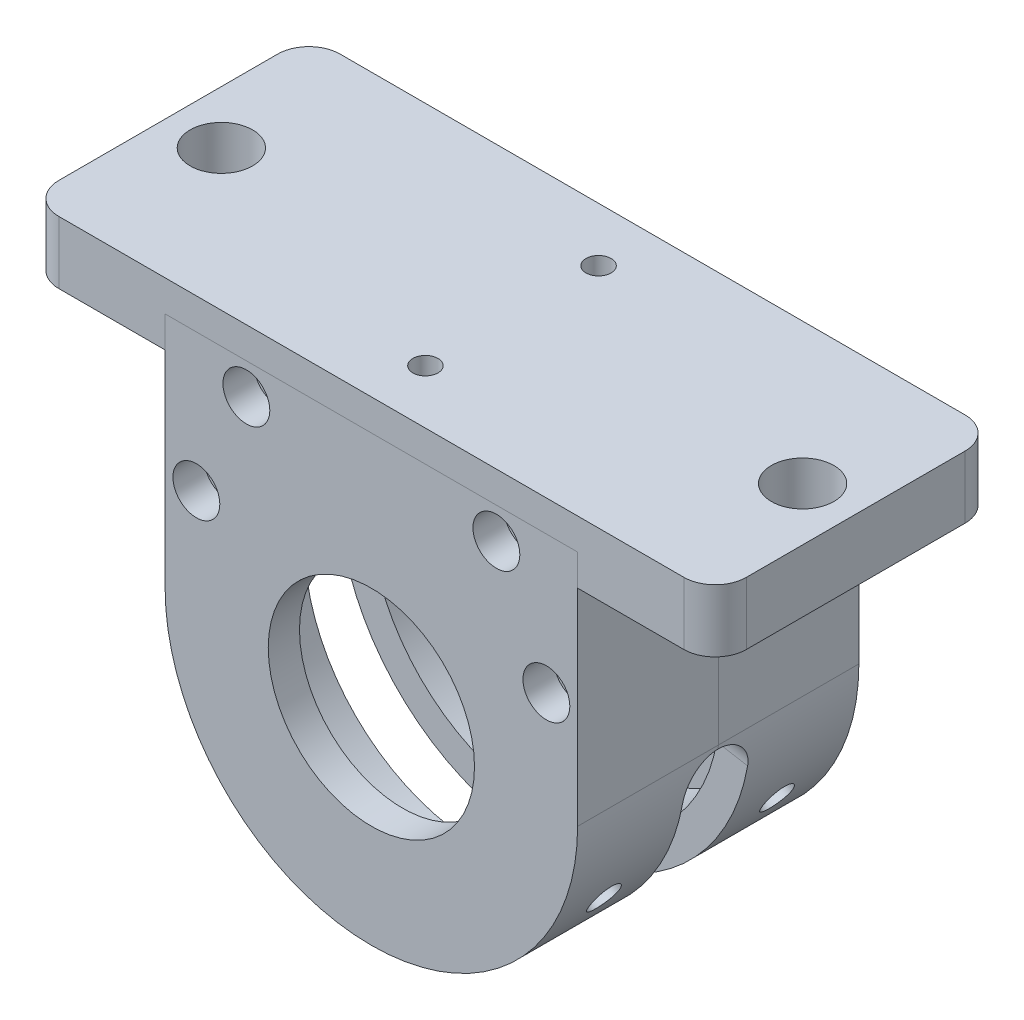
from build123d import *

# Parameters (mm, degrees)
BOSS_EXTRUDE1_DEPTH                          = 57.15
FILLET1_R                                    = 6.35
SKETCH3_R                                    = 6.35
CUT_EXTRUDE1_DEPTH                           = 50.8
SKETCH4_R                                    = 20.955
CUT_EXTRUDE2_DEPTH                           = 124.170359259
CUT_EXTRUDE3_DEPTH                           = 6.604
CUT_EXTRUDE4_REACH                           = 153.412
CUT_EXTRUDE6_START                           = -6.35
SKETCH10_R                                   = 35.56
CUT_EXTRUDE6_DEPTH                           = 117.820359373
SPLIT2_SURFACE_1_BACK                        = 180.16
SPLIT2_SURFACE_1_DEPTH                       = 360.32
SPLIT2_SURFACE_2_BACK                        = 180.16
SPLIT2_SURFACE_2_DEPTH                       = 360.32
SKETCH20_W                                   = 83.82
SKETCH20_H                                   = 90.17
CUT_EXTRUDE8_DEPTH                           = 113.788942488
CBORE_FOR_1_4_SOCKET_HEAD_CAP_SCREW1_2_COUNT = 2
CBORE_FOR_1_4_SOCKET_HEAD_CAP_SCREW1_2_PITCH = 71.12
CBORE_FOR_1_4_SOCKET_HEAD_CAP_SCREW1_3_COUNT = 2
CBORE_FOR_1_4_SOCKET_HEAD_CAP_SCREW1_3_PITCH = 23.86113367
CBORE_FOR_1_4_SOCKET_HEAD_CAP_SCREW1_4_COUNT = 2
CBORE_FOR_1_4_SOCKET_HEAD_CAP_SCREW1_4_PITCH = 64.670315447
F_1_4_20_TAPPED_HOLE1_AT_2_COUNT             = 2
F_1_4_20_TAPPED_HOLE1_AT_2_PITCH             = 35.179
CUT_EXTRUDE9_REACH                           = 148.49
CUT_EXTRUDE9_END_RADIUS                      = 35.56
SKETCH31_R                                   = 3.175


with BuildPart() as part:
    # Sketch1 → Boss-Extrude1 (new body)
    with BuildSketch(Plane.XY):
        with BuildLine():
            Line((-41.91, -41.91), (-41.91, 0))
            Line((-41.91, 0), (-69.85, 0))
            Line((-69.85, 0), (-69.85, 12.7))
            Line((-69.85, 12.7), (69.85, 12.7))
            Line((69.85, 12.7), (69.85, 0))
            Line((69.85, 0), (41.91, 0))
            Line((41.91, 0), (41.91, -41.91))
            ThreePointArc((41.91, -41.91), (0, -83.82), (-41.91, -41.91))
        make_face()
    extrude(amount=BOSS_EXTRUDE1_DEPTH)

    # Fillet1
    fillet1_edges = [part.edges().sort_by_distance(p)[0] for p in [
        (69.85, 6.35, 57.15),
        (69.85, 6.35, 0),
        (-69.85, 6.35, 0),
        (-69.85, 6.35, 57.15),
    ]]
    fillet(fillet1_edges, radius=FILLET1_R)

    # Sketch3 → Cut-Extrude1 (cut)
    with BuildSketch(Plane.XZ):
        with Locations((-59.055, 28.575)):
            Circle(SKETCH3_R)
        with Locations((59.055, 28.575)):
            Circle(SKETCH3_R)
    extrude(amount=-CUT_EXTRUDE1_DEPTH, mode=Mode.SUBTRACT)

    # Sketch4 → Cut-Extrude2 (cut, through all)
    with BuildSketch(Plane.XY.offset(57.15)):
        with Locations((0, -41.91)):
            Circle(SKETCH4_R)
    extrude(amount=-CUT_EXTRUDE2_DEPTH, mode=Mode.SUBTRACT)

    # Sketch6 → Cut-Extrude3 (cut, symmetric)
    with BuildSketch(Plane.XY.offset(28.575)):
        with BuildLine():
            Line((-41.273292929, -49.187595126), (-20.636646464, -45.548797563))
            ThreePointArc((-20.636646464, -45.548797563), (0, -62.865), (20.636646464, -45.548797563))
            Line((20.636646464, -45.548797563), (41.273292929, -49.187595126))
            ThreePointArc((41.273292929, -49.187595126), (0, -83.82), (-41.273292929, -49.187595126))
        make_face()
    extrude(amount=CUT_EXTRUDE3_DEPTH, both=True, mode=Mode.SUBTRACT)

    # Sketch8 → Cut-Extrude4 (cut, up to next)
    with BuildSketch(Plane(origin=(48.440325032, -8.541336257, 0), x_dir=(0, 0, -1), z_dir=(0.984807753012209, -0.1736481776669248, 0)), mode=Mode.PRIVATE) as cut_extrude4_sk1:
        with BuildLine():
            Line((-35.179, -41.273292929), (-21.971, -41.273292929))
            ThreePointArc((-21.971, -41.273292929), (-28.575, -34.669292929), (-35.179, -41.273292929))
        make_face()
    cut_extrude4_tool1 = extrude(cut_extrude4_sk1.sketch, amount=-CUT_EXTRUDE4_REACH, mode=Mode.PRIVATE) & part.part
    cut_extrude4 = cut_extrude4_tool1.solids().sort_by_distance((41.759998, -46.427352, 28.575))[0]
    add(cut_extrude4, mode=Mode.SUBTRACT)

    # Mirror1: Cut-Extrude4 across plane
    add(cut_extrude4.mirror(Plane(origin=(0, 0, 0), x_dir=(0, 0, 1), z_dir=(1, 0, 0))), mode=Mode.SUBTRACT)

    # Sketch10 → Cut-Extrude6 (cut, through all)
    with BuildSketch(Plane(origin=(0, 0, 0), x_dir=(-1, 0, 0), z_dir=(0, 0, -1)).offset(CUT_EXTRUDE6_START)):
        with Locations((0, -41.91)):
            Circle(SKETCH10_R)
    extrude(amount=-CUT_EXTRUDE6_DEPTH, mode=Mode.SUBTRACT)


with BuildPart() as body_2:
    # Split2: the piece behind the surface
    add(part.part)
    # Split2 surface: a surface, the sketch's curves swept straight by 360.32 mm
    with BuildLine(Plane(origin=(0, 0, 28.575), x_dir=(-1, 0, 0), z_dir=(0, 0, -1)).offset(-SPLIT2_SURFACE_1_BACK), mode=Mode.PRIVATE) as split2_surface_1_path:
        Line((41.91, 6.35), (-41.91, 6.35))
        Line((-41.91, 6.35), (-41.91, -83.82))
        Line((-41.91, -83.82), (41.91, -83.82))
        Line((41.91, -83.82), (41.91, 6.35))
    split2_surface_1 = Shell.extrude(split2_surface_1_path.wire(), (0 * SPLIT2_SURFACE_1_DEPTH, 0 * SPLIT2_SURFACE_1_DEPTH, -1 * SPLIT2_SURFACE_1_DEPTH))
    split(bisect_by=split2_surface_1, keep=Keep.BOTTOM)


with BuildPart() as part_1:
    add(part.part)

    # Split2: split by a surface, the side it looks to stays
    # Split2 surface: a surface, the sketch's curves swept straight by 360.32 mm
    with BuildLine(Plane(origin=(0, 0, 28.575), x_dir=(-1, 0, 0), z_dir=(0, 0, -1)).offset(-SPLIT2_SURFACE_2_BACK), mode=Mode.PRIVATE) as split2_surface_2_path:
        Line((41.91, 6.35), (-41.91, 6.35))
        Line((-41.91, 6.35), (-41.91, -83.82))
        Line((-41.91, -83.82), (41.91, -83.82))
        Line((41.91, -83.82), (41.91, 6.35))
    split2_surface_2 = Shell.extrude(split2_surface_2_path.wire(), (0 * SPLIT2_SURFACE_2_DEPTH, 0 * SPLIT2_SURFACE_2_DEPTH, -1 * SPLIT2_SURFACE_2_DEPTH))
    split(bisect_by=split2_surface_2, keep=Keep.TOP)

    # Sketch20 → Cut-Extrude8 (cut, through all)
    with BuildSketch(Plane(origin=(0, 0, 28.575), x_dir=(-1, 0, 0), z_dir=(0, 0, -1))):
        with Locations((0, -38.735)):
            Rectangle(SKETCH20_W, SKETCH20_H)
    extrude(amount=-CUT_EXTRUDE8_DEPTH, mode=Mode.SUBTRACT)


with BuildPart() as body_3:
    # Mirror3: mirrored copy
    add(part_1.part.mirror(Plane.XY.offset(28.575)))


with BuildPart() as cbore_for_1_4_socket_head_cap_screw1_for_tool:
    # Sketch25 → CBORE for 1/4 Socket Head Cap Screw1 for 92196A434 (revolve)
    with BuildSketch(Plane(origin=(-35.56, -21.59, 57.15), x_dir=(0, -1, 0), z_dir=(1, 0, 0))):
        Polygon((0, 0), (0, 57.15), (3.175, 57.15), (3.175, 6.35), (4.7625, 6.35), (4.7625, 0), align=None)
    cbore_for_1_4_socket_head_cap_screw1_for = revolve(axis=Axis((-35.56, -21.59, 63.5), (0, 0, -1)))


with BuildPart() as part_2:
    add(part_1.part)

    # CBORE for 1/4 Socket Head Cap Screw1 for 92196A434: cut by cbore_for_1_4_socket_head_cap_screw1_for_tool
    add(cbore_for_1_4_socket_head_cap_screw1_for_tool.part, mode=Mode.SUBTRACT)


with BuildPart() as body_3_1:
    add(body_3.part)

    # CBORE for 1/4 Socket Head Cap Screw1 for 92196A434: cut by cbore_for_1_4_socket_head_cap_screw1_for_tool
    add(cbore_for_1_4_socket_head_cap_screw1_for_tool.part, mode=Mode.SUBTRACT)


with BuildPart() as cbore_for_1_4_socket_head_cap_screw1_2_tool:
    # CBORE for 1_4 Socket Head Cap Screw1 2: CBORE for 1/4 Socket Head Cap Screw1 for 92196A434 ×2
    with Locations(*[(i * CBORE_FOR_1_4_SOCKET_HEAD_CAP_SCREW1_2_PITCH, 0, 0) for i in range(1, CBORE_FOR_1_4_SOCKET_HEAD_CAP_SCREW1_2_COUNT)]):
        add(cbore_for_1_4_socket_head_cap_screw1_for)


with BuildPart() as part_3:
    add(part_2.part)

    # CBORE for 1_4 Socket Head Cap Screw1 2: cut by cbore_for_1_4_socket_head_cap_screw1_2_tool
    add(cbore_for_1_4_socket_head_cap_screw1_2_tool.part, mode=Mode.SUBTRACT)


with BuildPart() as body_3_2:
    add(body_3_1.part)

    # CBORE for 1_4 Socket Head Cap Screw1 2: cut by cbore_for_1_4_socket_head_cap_screw1_2_tool
    add(cbore_for_1_4_socket_head_cap_screw1_2_tool.part, mode=Mode.SUBTRACT)


with BuildPart() as cbore_for_1_4_socket_head_cap_screw1_3_tool:
    # CBORE for 1_4 Socket Head Cap Screw1 3: CBORE for 1/4 Socket Head Cap Screw1 for 92196A434 ×2
    with Locations(*[Vector(0.42579703632987925, 0.9048187022009943, 0) * (i * CBORE_FOR_1_4_SOCKET_HEAD_CAP_SCREW1_3_PITCH) for i in range(1, CBORE_FOR_1_4_SOCKET_HEAD_CAP_SCREW1_3_COUNT)]):
        add(cbore_for_1_4_socket_head_cap_screw1_for)


with BuildPart() as part_4:
    add(part_3.part)

    # CBORE for 1_4 Socket Head Cap Screw1 3: cut by cbore_for_1_4_socket_head_cap_screw1_3_tool
    add(cbore_for_1_4_socket_head_cap_screw1_3_tool.part, mode=Mode.SUBTRACT)


with BuildPart() as body_3_3:
    add(body_3_2.part)

    # CBORE for 1_4 Socket Head Cap Screw1 3: cut by cbore_for_1_4_socket_head_cap_screw1_3_tool
    add(cbore_for_1_4_socket_head_cap_screw1_3_tool.part, mode=Mode.SUBTRACT)


with BuildPart() as cbore_for_1_4_socket_head_cap_screw1_4_tool:
    # CBORE for 1_4 Socket Head Cap Screw1 4: CBORE for 1/4 Socket Head Cap Screw1 for 92196A434 ×2
    with Locations(*[Vector(0.9426272251612073, 0.3338471422445945, 0) * (i * CBORE_FOR_1_4_SOCKET_HEAD_CAP_SCREW1_4_PITCH) for i in range(1, CBORE_FOR_1_4_SOCKET_HEAD_CAP_SCREW1_4_COUNT)]):
        add(cbore_for_1_4_socket_head_cap_screw1_for)


with BuildPart() as part_5:
    add(part_4.part)

    # CBORE for 1_4 Socket Head Cap Screw1 4: cut by cbore_for_1_4_socket_head_cap_screw1_4_tool
    add(cbore_for_1_4_socket_head_cap_screw1_4_tool.part, mode=Mode.SUBTRACT)


with BuildPart() as body_3_4:
    add(body_3_3.part)

    # CBORE for 1_4 Socket Head Cap Screw1 4: cut by cbore_for_1_4_socket_head_cap_screw1_4_tool
    add(cbore_for_1_4_socket_head_cap_screw1_4_tool.part, mode=Mode.SUBTRACT)


with BuildPart() as f_1_4_20_tapped_hole1_tool:
    # Sketch28 → 1/4-20 Tapped Hole1 (revolve)
    with BuildSketch(Plane(origin=(0, 12.7, 10.9855), x_dir=(0, 0, 1), z_dir=(1, 0, 0))):
        Polygon((0, 0), (0, 21.853816902), (2.5527, 20.32), (2.5527, 0), align=None)
    f_1_4_20_tapped_hole1 = revolve(axis=Axis((0, 19.05, 10.9855), (0, -1, 0)))


with BuildPart() as part_6:
    add(part_5.part)

    # 1/4-20 Tapped Hole1: cut by f_1_4_20_tapped_hole1_tool
    add(f_1_4_20_tapped_hole1_tool.part, mode=Mode.SUBTRACT)


with BuildPart() as body_2_1:
    add(body_2.part)

    # 1/4-20 Tapped Hole1: cut by f_1_4_20_tapped_hole1_tool
    add(f_1_4_20_tapped_hole1_tool.part, mode=Mode.SUBTRACT)


with BuildPart() as f_1_4_20_tapped_hole1_at_2_tool:
    # 1/4-20 Tapped Hole1 at 2: 1/4-20 Tapped Hole1 ×2
    with Locations(*[(0, 0, i * F_1_4_20_TAPPED_HOLE1_AT_2_PITCH) for i in range(1, F_1_4_20_TAPPED_HOLE1_AT_2_COUNT)]):
        add(f_1_4_20_tapped_hole1)


with BuildPart() as body_2_2:
    add(body_2_1.part)

    # 1/4-20 Tapped Hole1 at 2: cut by f_1_4_20_tapped_hole1_at_2_tool
    add(f_1_4_20_tapped_hole1_at_2_tool.part, mode=Mode.SUBTRACT)


with BuildPart() as body_3_5:
    add(body_3_4.part)

    # 1/4-20 Tapped Hole1 at 2: cut by f_1_4_20_tapped_hole1_at_2_tool
    add(f_1_4_20_tapped_hole1_at_2_tool.part, mode=Mode.SUBTRACT)


with BuildPart() as cut_extrude9_tool:
    # Cut-Extrude9: up to this cylinder (the profile starts outside it)
    cut_extrude9_end = Plane(origin=(0, -41.91, 28.575), z_dir=(0, 0, 1)) * Cylinder(CUT_EXTRUDE9_END_RADIUS, 404.279, mode=Mode.PRIVATE)
    # Sketch31 → Cut-Extrude9 (new, up to the surface)
    with BuildSketch(Plane(origin=(54.442687009, -31.4325, 0), x_dir=(0, 0, 1), z_dir=(0.8660254037844368, -0.5000000000000033, 0)), mode=Mode.PRIVATE) as cut_extrude9_sk1:
        with Locations((46.1645, 36.295124673)):
            Circle(SKETCH31_R)
    cut_extrude9_tool1 = extrude(cut_extrude9_sk1.sketch, amount=-CUT_EXTRUDE9_REACH, mode=Mode.PRIVATE) - cut_extrude9_end
    # Sketch31 → Cut-Extrude9 (new, up to the surface)
    with BuildSketch(Plane(origin=(54.442687009, -31.4325, 0), x_dir=(0, 0, 1), z_dir=(0.8660254037844368, -0.5000000000000033, 0)), mode=Mode.PRIVATE) as cut_extrude9_sk2:
        with Locations((10.9855, 36.295124673)):
            Circle(SKETCH31_R)
    cut_extrude9_tool2 = extrude(cut_extrude9_sk2.sketch, amount=-CUT_EXTRUDE9_REACH, mode=Mode.PRIVATE) - cut_extrude9_end
    cut_extrude9 = cut_extrude9_tool1.solids().sort_by_distance((36.295125, -62.865, 46.1645))[0] + cut_extrude9_tool2.solids().sort_by_distance((36.295125, -62.865, 10.9855))[0]
    add(cut_extrude9)


with BuildPart() as part_7:
    add(part_6.part)

    # Cut-Extrude9: cut by cut_extrude9_tool
    add(cut_extrude9_tool.part, mode=Mode.SUBTRACT)


with BuildPart() as body_3_6:
    add(body_3_5.part)

    # Cut-Extrude9: cut by cut_extrude9_tool
    add(cut_extrude9_tool.part, mode=Mode.SUBTRACT)


with BuildPart() as mirror4_tool:
    # Mirror4: Cut-Extrude9 across plane
    add(cut_extrude9.mirror(Plane(origin=(0, 0, 0), x_dir=(0, 0, 1), z_dir=(1, 0, 0))))


with BuildPart() as part_8:
    add(part_7.part)

    # Mirror4: cut by mirror4_tool
    add(mirror4_tool.part, mode=Mode.SUBTRACT)


with BuildPart() as body_3_7:
    add(body_3_6.part)

    # Mirror4: cut by mirror4_tool
    add(mirror4_tool.part, mode=Mode.SUBTRACT)


solid = Compound([body_2_2.part, part_8.part, body_3_7.part])
